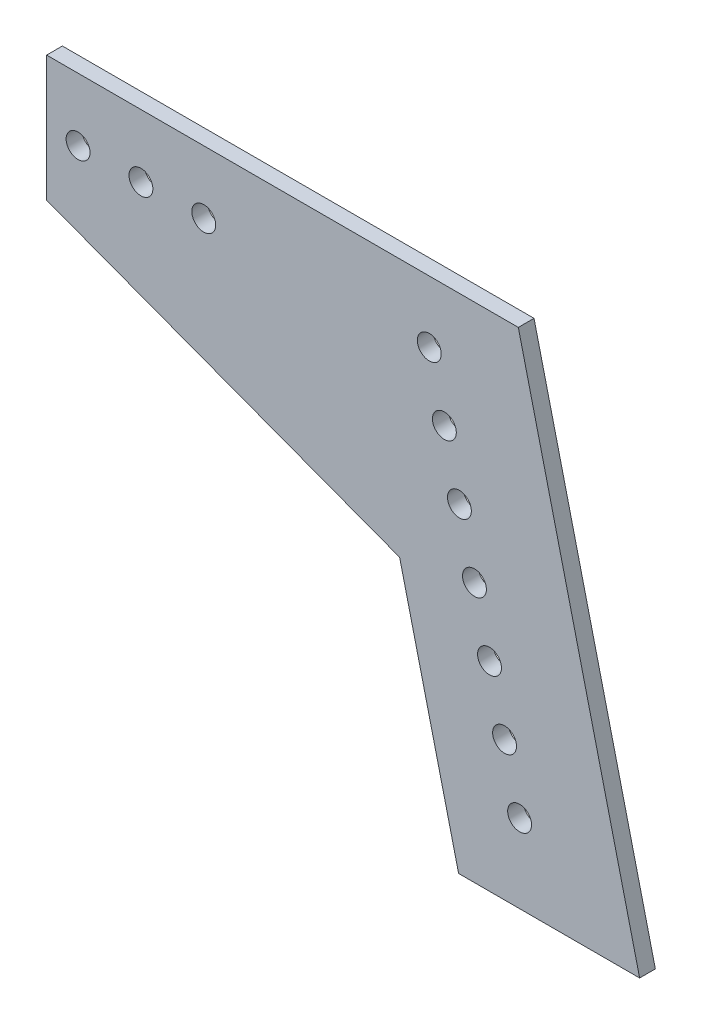
from build123d import *

# Parameters (mm, degrees)
SKETCH1_W           = 381
SKETCH1_H           = 177.8
BOSS_EXTRUDE1_DEPTH = 3.175
CUT_EXTRUDE1_DEPTH  = 211.246380766
CUT_EXTRUDE2_DEPTH  = 205.829884405
CUT_EXTRUDE3_DEPTH  = 200.326767223
SKETCH9_R           = 2.413
CUT_EXTRUDE5_DEPTH  = 200.326767223
CUT_EXTRUDE6_DEPTH  = 200.326767223
CUT_EXTRUDE7_DEPTH  = 190.367896253
SKETCH12_R          = 2.413
CUT_EXTRUDE8_DEPTH  = 188.550586603


with BuildPart() as part:
    # Sketch1 → Boss-Extrude1 (new body)
    with BuildSketch(Plane.XY):
        Rectangle(SKETCH1_W, SKETCH1_H)
    extrude(amount=BOSS_EXTRUDE1_DEPTH)

    # Sketch3 → Cut-Extrude1 (cut, through all)
    with BuildSketch(Plane(origin=(0, 0, 0), x_dir=(-1, 0, 0), z_dir=(0, 0, -1))):
        Polygon((-190.5, 88.9), (-139.670694847, 88.9), (-190.5, -121.745827518), align=None)
        Polygon((190.5, 88.9), (141.601183723, 88.9), (190.5, -113.745532698), align=None)
    extrude(amount=-CUT_EXTRUDE1_DEPTH, mode=Mode.SUBTRACT)

    # Sketch4 → Cut-Extrude2 (cut, through all)
    with BuildSketch(Plane(origin=(0, 0, 0), x_dir=(-1, 0, 0), z_dir=(0, 0, -1))):
        Polygon((178.375641573, -63.5), (-176.445152697, -63.5), (-182.574229005, -88.9), (184.504717881, -88.9), align=None)
    extrude(amount=-CUT_EXTRUDE2_DEPTH, mode=Mode.SUBTRACT)

    # Sketch8 → Cut-Extrude3 (cut, through all)
    with BuildSketch(Plane(origin=(0, 0, 0), x_dir=(-1, 0, 0), z_dir=(0, 0, -1))):
        Polygon((-139.864527638, -63.5), (-127.945162942, -14.118133437), (132.284027695, -14.118133437), (144.203392391, -63.5), align=None)
    extrude(amount=-CUT_EXTRUDE3_DEPTH, mode=Mode.SUBTRACT)

    # Sketch9 → Cut-Extrude5 (cut, through all)
    with BuildSketch(Plane(origin=(0, 0, 0), x_dir=(-1, 0, 0), z_dir=(0, 0, -1))):
        with Locations((-152.192493977, -47.625)):
            Circle(SKETCH9_R)
        with Locations((-149.151314542, -35.414265987)):
            Circle(SKETCH9_R)
        with Locations((-146.110135107, -23.203531973)):
            Circle(SKETCH9_R)
        with Locations((-143.068955672, -10.99279796)):
            Circle(SKETCH9_R)
        with Locations((-140.027776237, 1.217936053)):
            Circle(SKETCH9_R)
        with Locations((-136.986596801, 13.428670067)):
            Circle(SKETCH9_R)
        with Locations((-133.945417366, 25.63940408)):
            Circle(SKETCH9_R)
        with Locations((-124.821879061, 62.27160612)):
            Circle(SKETCH9_R)
        with Locations((-121.780699626, 74.482340133)):
            Circle(SKETCH9_R)
    extrude(amount=-CUT_EXTRUDE5_DEPTH, mode=Mode.SUBTRACT)

    # Sketch10 → Cut-Extrude6 (cut, through all)
    with BuildSketch(Plane(origin=(0, 0, 0), x_dir=(-1, 0, 0), z_dir=(0, 0, -1))):
        Polygon((-139.670694847, 88.9), (-151.928847464, 38.1), (153.859336339, 38.1), (141.601183723, 88.9), align=None)
    extrude(amount=-CUT_EXTRUDE6_DEPTH, mode=Mode.SUBTRACT)

    # Sketch11 → Cut-Extrude7 (cut, through all)
    with BuildSketch(Plane(origin=(0, 0, 0), x_dir=(-1, 0, 0), z_dir=(0, 0, -1))):
        Polygon((-127.945162942, -14.118133437), (-56.620358568, 12.7), (-56.620358568, 38.1), (60.959223321, 38.1), (153.859336339, 38.1), (178.375641573, -63.5), (144.203392391, -63.5), (132.284027695, -14.118133437), align=None)
    extrude(amount=-CUT_EXTRUDE7_DEPTH, mode=Mode.SUBTRACT)

    # Sketch12 → Cut-Extrude8 (cut, through all)
    with BuildSketch(Plane(origin=(0, 0, 0), x_dir=(-1, 0, 0), z_dir=(0, 0, -1))):
        with Locations((-62.970358568, 25.4)):
            Circle(SKETCH12_R)
        with Locations((-75.670358568, 25.4)):
            Circle(SKETCH12_R)
        with Locations((-88.370358568, 25.4)):
            Circle(SKETCH12_R)
    extrude(amount=-CUT_EXTRUDE8_DEPTH, mode=Mode.SUBTRACT)


solid = part.part
